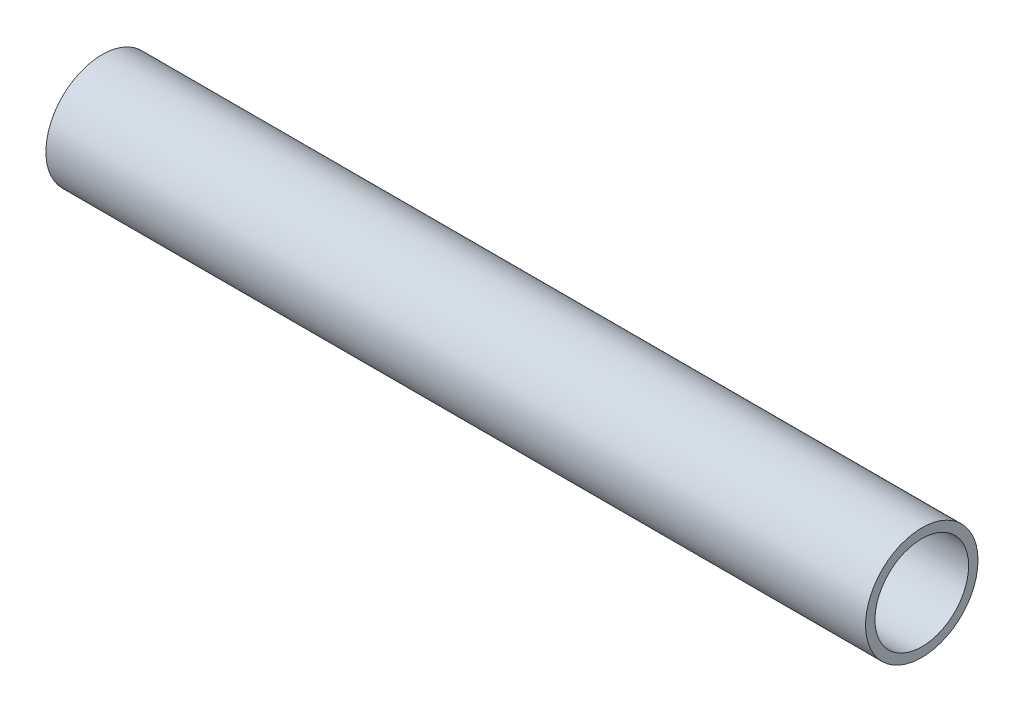
from build123d import *

# Parameters (mm, degrees)
SKETCH1_R           = 2.4
SKETCH1_R_2         = 2
BOSS_EXTRUDE1_DEPTH = 35


with BuildPart() as part:
    # Sketch1 → Boss-Extrude1 (new body)
    with BuildSketch(Plane(origin=(0, 0, 0), x_dir=(0, 0, -1), z_dir=(1, 0, 0))):
        Circle(SKETCH1_R)
        Circle(SKETCH1_R_2, mode=Mode.SUBTRACT)
    extrude(amount=BOSS_EXTRUDE1_DEPTH)


solid = part.part
